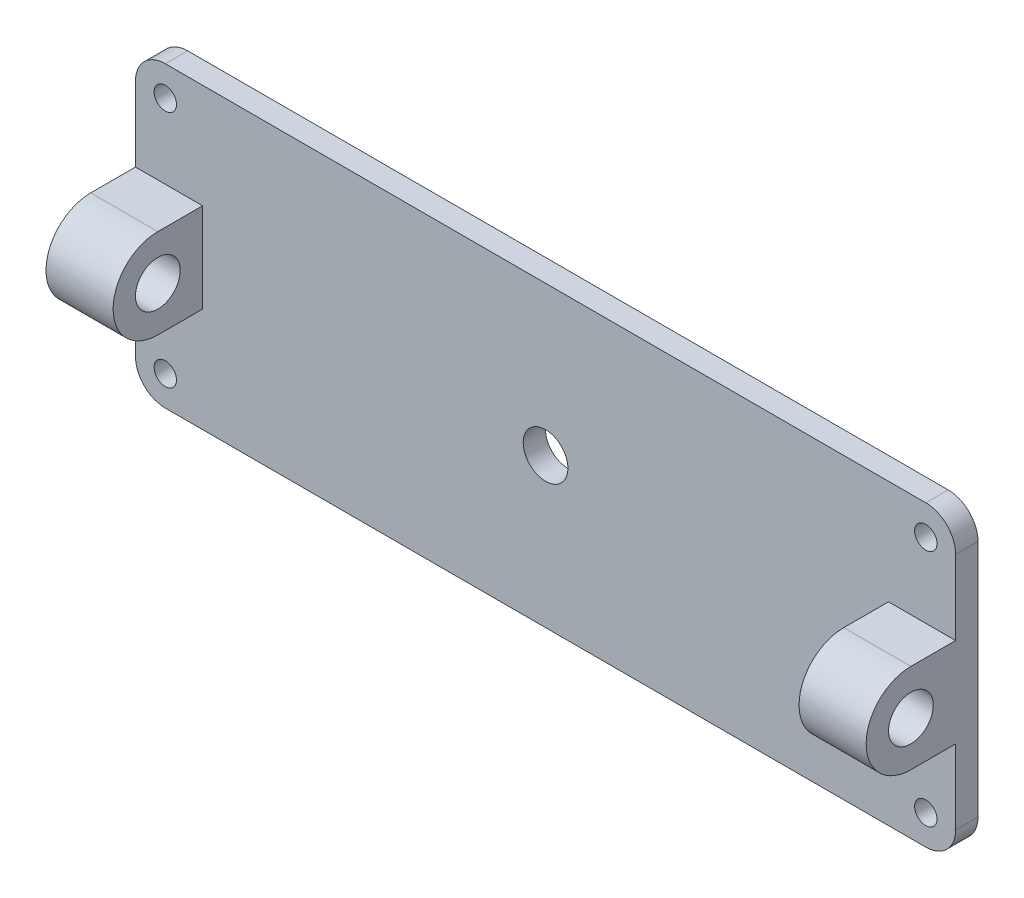
from build123d import *

# Parameters (mm, degrees)
SKETCH1_W           = 698.5
SKETCH1_H           = 254
SKETCH1_R           = 19.05
SKETCH1_R_2         = 9.525
BOSS_EXTRUDE1_DEPTH = 19.05
FILLET3_R           = 25.4
FILLET4_R           = 25.4
FILLET5_R           = 25.4
FILLET6_R           = 25.4
SKETCH2_R           = 19.05
BOSS_EXTRUDE2_DEPTH = 57.15


with BuildPart() as part:
    # Sketch1 → Boss-Extrude1 (new body)
    with BuildSketch(Plane.XY):
        Rectangle(SKETCH1_W, SKETCH1_H)
        with Locations(Location((0, 0, 0), (0, 0, 180))):
            Circle(SKETCH1_R, mode=Mode.SUBTRACT)
        with Locations(Location((-323.85, 101.6, 0), (0, 0, 180))):
            Circle(SKETCH1_R_2, mode=Mode.SUBTRACT)
        with Locations(Location((323.85, 101.6, 0), (0, 0, 180))):
            Circle(SKETCH1_R_2, mode=Mode.SUBTRACT)
        with Locations(Location((323.85, -101.6, 0), (0, 0, 180))):
            Circle(SKETCH1_R_2, mode=Mode.SUBTRACT)
        with Locations(Location((-323.85, -101.6, 0), (0, 0, 180))):
            Circle(SKETCH1_R_2, mode=Mode.SUBTRACT)
    extrude(amount=BOSS_EXTRUDE1_DEPTH)

    # Fillet3
    fillet3_edges = [part.edges().sort_by_distance(p)[0] for p in [
        (-349.25, 127, 9.525),
    ]]
    fillet(fillet3_edges, radius=FILLET3_R)

    # Fillet4
    fillet4_edges = [part.edges().sort_by_distance(p)[0] for p in [
        (-349.25, -127, 9.525),
    ]]
    fillet(fillet4_edges, radius=FILLET4_R)

    # Fillet5
    fillet5_edges = [part.edges().sort_by_distance(p)[0] for p in [
        (349.25, -127, 9.525),
    ]]
    fillet(fillet5_edges, radius=FILLET5_R)

    # Fillet6
    fillet6_edges = [part.edges().sort_by_distance(p)[0] for p in [
        (349.25, 127, 9.525),
    ]]
    fillet(fillet6_edges, radius=FILLET6_R)

    # Sketch2 → Boss-Extrude2 (add)
    with BuildSketch(Plane(origin=(349.25, 0, 0), x_dir=(0, 0, -1), z_dir=(1, 0, 0))):
        with BuildLine():
            Line((-19.05, 38.1), (-19.05, -38.1))
            Line((-19.05, -38.1), (-57.15, -38.1))
            ThreePointArc((-57.15, -38.1), (-95.25, 0), (-57.15, 38.1))
            Line((-57.15, 38.1), (-19.05, 38.1))
        make_face()
        with Locations((-57.15, 0)):
            Circle(SKETCH2_R, mode=Mode.SUBTRACT)
    boss_extrude2 = extrude(amount=-BOSS_EXTRUDE2_DEPTH)

    # Mirror3: Boss-Extrude2 across plane
    add(boss_extrude2.mirror(Plane.ZY))


solid = part.part
